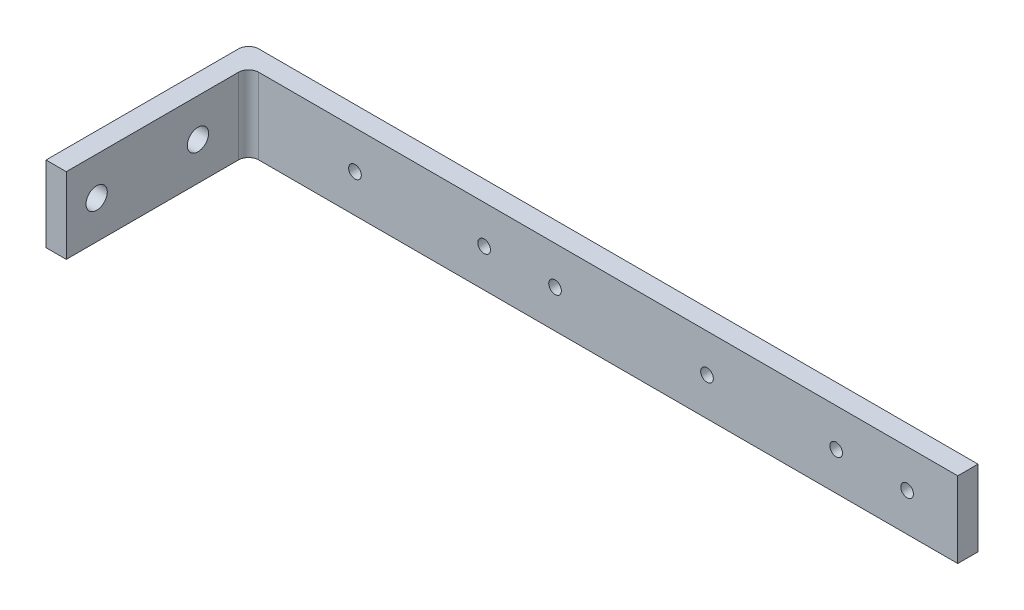
from build123d import *

# Parameters (mm, degrees)
SKETCH1_W             = 140
SKETCH1_H             = 15
BOSS_EXTRUDE1_DEPTH   = 4
M3X0_5_TAPPED_HOLE1_D = 2.5
SKETCH6_W             = 40
SKETCH6_H             = 15
BOSS_EXTRUDE2_DEPTH   = 4
FILLET1_R             = 2
F_4_0MM_DOWEL_HOLE1_D = 4.2


with BuildPart() as part:
    # Sketch1 → Boss-Extrude1 (new body)
    with BuildSketch(Plane.XY):
        with Locations((70, 7.5)):
            Rectangle(SKETCH1_W, SKETCH1_H)
    extrude(amount=BOSS_EXTRUDE1_DEPTH)

    # M3x0.5 Tapped Hole1 (through all)
    with Locations(Plane(origin=(0, 0, 0), x_dir=(-1, 0, 0), z_dir=(0, 0, -1))):
        with Locations((-130, 7.5), (-116, 7.5), (-90.5, 7.5), (-60.5, 7.5), (-46.5, 7.5), (-21, 7.5)):
            Hole(M3X0_5_TAPPED_HOLE1_D / 2)

    # Sketch6 → Boss-Extrude2 (add)
    with BuildSketch(Plane.ZY):
        with Locations((20, 7.5)):
            Rectangle(SKETCH6_W, SKETCH6_H)
    extrude(amount=BOSS_EXTRUDE2_DEPTH)

    # Fillet1
    fillet1_edges = [part.edges().sort_by_distance(p)[0] for p in [
        (0, 7.5, 4),
        (-4, 7.5, 0),
    ]]
    fillet(fillet1_edges, radius=FILLET1_R)

    # Ø4.0mm Dowel Hole1 (through all)
    with Locations(Plane.ZY.offset(4)):
        with Locations((34, 7.5), (14, 7.5)):
            Hole(F_4_0MM_DOWEL_HOLE1_D / 2)


solid = part.part
